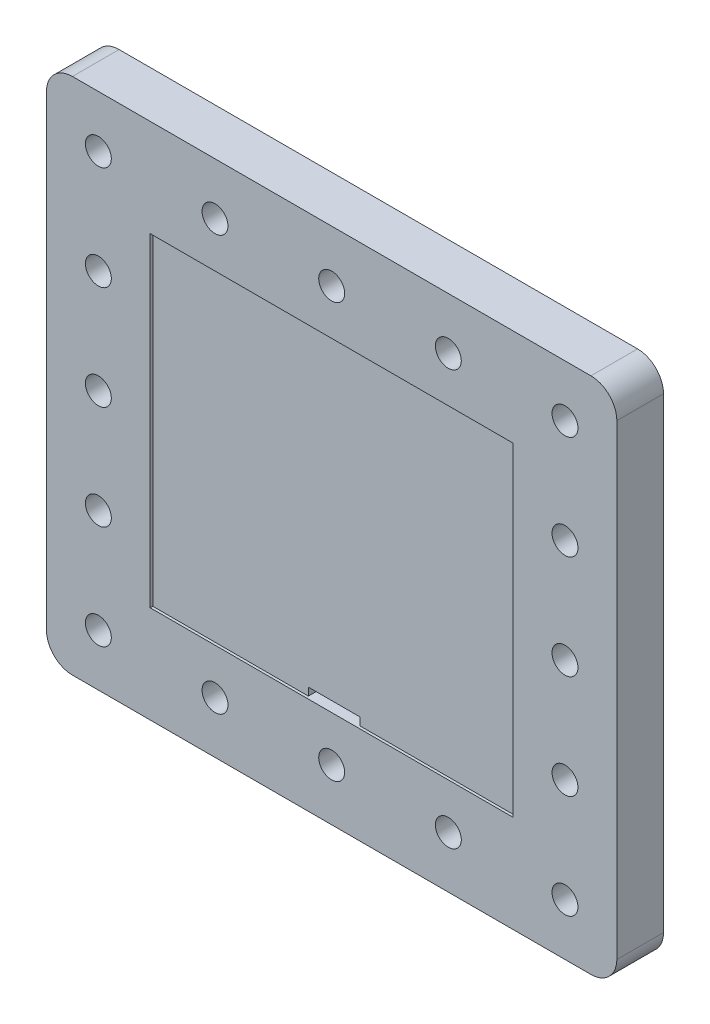
from build123d import *

# Parameters (mm, degrees)
SKETCH_1_R               = 5
EXTRUDE_1_DEPTH          = 5
SKETCH_3_W               = 200
SKETCH_3_H               = 180
EXTRUDE_2_DEPTH          = 8
SKETCH_4_W               = 140
SKETCH_4_H               = 125
CUT_EXTRUDE_1_DEPTH      = 1
CUT_EXTRUDE_2_DEPTH      = 150.629542538
CUT_EXTRUDE_2_DEPTH_BACK = 150.629542538
SKETCH_6_W               = 20
SKETCH_6_H               = 3
CUT_EXTRUDE_3_DEPTH      = 5


with BuildPart() as part:
    # 草图1 → 凸台-拉伸1 (new, symmetric)
    with BuildSketch(Plane.XY):
        with BuildLine():
            Line((-100, -100), (100, -100))
            ThreePointArc((100, -100), (107.071067812, -97.071067812), (110, -90))
            Line((110, -90), (110, 90))
            ThreePointArc((110, 90), (107.071067812, 97.071067812), (100, 100))
            Line((100, 100), (-100, 100))
            ThreePointArc((-100, 100), (-107.071067812, 97.071067812), (-110, 90))
            Line((-110, 90), (-110, -90))
            ThreePointArc((-110, -90), (-107.071067812, -97.071067812), (-100, -100))
        make_face()
        with Locations((-90, 0)):
            Circle(SKETCH_1_R, mode=Mode.SUBTRACT)
        with Locations((90, 0)):
            Circle(SKETCH_1_R, mode=Mode.SUBTRACT)
        with Locations((-90, 40)):
            Circle(SKETCH_1_R, mode=Mode.SUBTRACT)
        with Locations((-90, -40)):
            Circle(SKETCH_1_R, mode=Mode.SUBTRACT)
        with Locations(Location((90, -40, 0), (0, 0, 180))):
            Circle(SKETCH_1_R, mode=Mode.SUBTRACT)
        with Locations(Location((90, 40, 0), (0, 0, 180))):
            Circle(SKETCH_1_R, mode=Mode.SUBTRACT)
        with Locations((-90, -80)):
            Circle(SKETCH_1_R, mode=Mode.SUBTRACT)
        with Locations((-90, 80)):
            Circle(SKETCH_1_R, mode=Mode.SUBTRACT)
        with Locations(Location((90, -80, 0), (0, 0, 180))):
            Circle(SKETCH_1_R, mode=Mode.SUBTRACT)
        with Locations(Location((90, 80, 0), (0, 0, 180))):
            Circle(SKETCH_1_R, mode=Mode.SUBTRACT)
        with Locations((0, 80)):
            Circle(SKETCH_1_R, mode=Mode.SUBTRACT)
        with Locations((-45, 80)):
            Circle(SKETCH_1_R, mode=Mode.SUBTRACT)
        with Locations((45, 80)):
            Circle(SKETCH_1_R, mode=Mode.SUBTRACT)
        with Locations(Location((45, -80, 0), (0, 0, 180))):
            Circle(SKETCH_1_R, mode=Mode.SUBTRACT)
        with Locations(Location((0, -80, 0), (0, 0, 180))):
            Circle(SKETCH_1_R, mode=Mode.SUBTRACT)
        with Locations(Location((-45, -80, 0), (0, 0, 180))):
            Circle(SKETCH_1_R, mode=Mode.SUBTRACT)
    extrude(amount=EXTRUDE_1_DEPTH, both=True)

    # 草图3 → 凸台-拉伸2 (add)
    with BuildSketch(Plane(origin=(0, 0, -5), x_dir=(-1, 0, 0), z_dir=(0, 0, -1))):
        with BuildLine():
            Line((110, 90), (110, -90))
            ThreePointArc((110, -90), (107.071067812, -97.071067812), (100, -100))
            Line((100, -100), (-100, -100))
            ThreePointArc((-100, -100), (-107.071067812, -97.071067812), (-110, -90))
            Line((-110, -90), (-110, 90))
            ThreePointArc((-110, 90), (-107.071067812, 97.071067812), (-100, 100))
            Line((-100, 100), (100, 100))
            ThreePointArc((100, 100), (107.071067812, 97.071067812), (110, 90))
        make_face()
        Rectangle(SKETCH_3_W, SKETCH_3_H, mode=Mode.SUBTRACT)
    extrude(amount=EXTRUDE_2_DEPTH)

    # 草图4 → 切除-拉伸1 (cut)
    with BuildSketch(Plane.XY.offset(5)):
        Rectangle(SKETCH_4_W, SKETCH_4_H)
    extrude(amount=-CUT_EXTRUDE_1_DEPTH, mode=Mode.SUBTRACT)

    # 草图5 → 切除-拉伸2 (cut, two sides: drawn at the far end of the back side and taken through both)
    with BuildSketch(Plane.XY.offset(4).offset(-CUT_EXTRUDE_2_DEPTH_BACK)):
        Polygon((0, -62.5), (10, -62.5), (10, -59.5), (-10, -59.5), (-10, -62.5), align=None)
    extrude(amount=CUT_EXTRUDE_2_DEPTH + CUT_EXTRUDE_2_DEPTH_BACK, mode=Mode.SUBTRACT)

    # 草图6 → 切除-拉伸3 (cut)
    with BuildSketch(Plane.XZ.offset(100)):
        with Locations((0, -11.5)):
            Rectangle(SKETCH_6_W, SKETCH_6_H)
    extrude(amount=-CUT_EXTRUDE_3_DEPTH, mode=Mode.SUBTRACT)


solid = part.part
